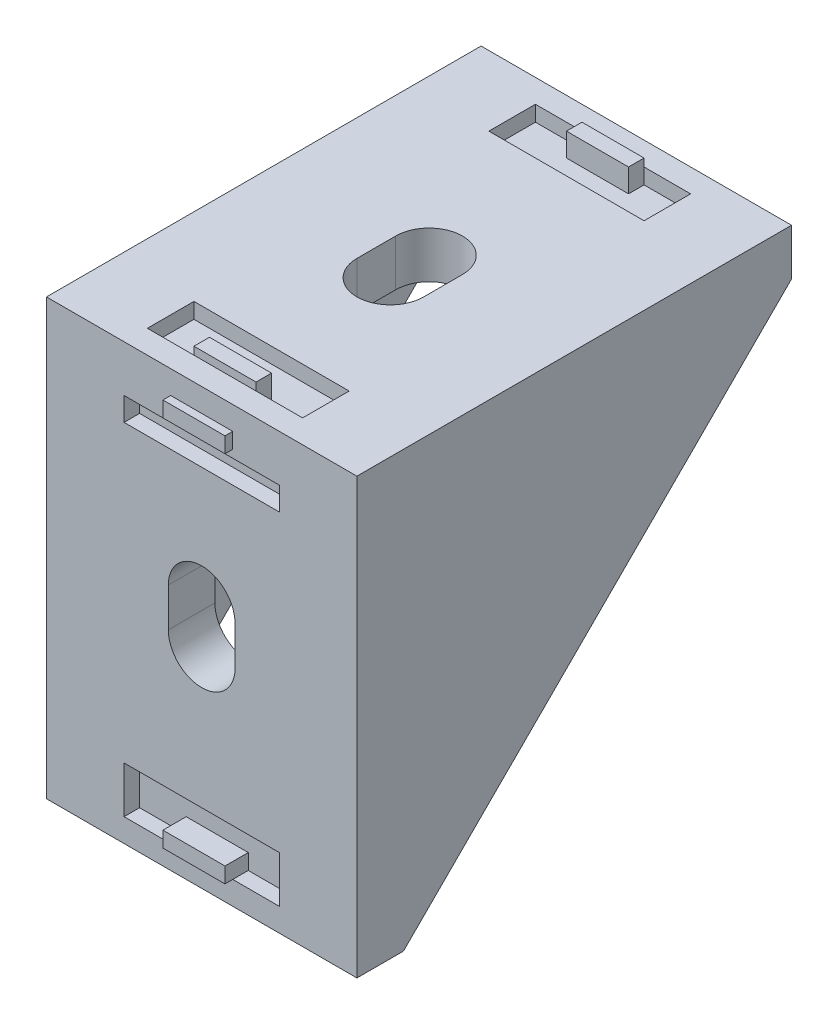
from build123d import *

# Parameters (mm, degrees)
SKETCH_1_W               = 20
SKETCH_1_H               = 28
EXTRUDE_1_DEPTH          = 3
SKETCH_2_W               = 10
SKETCH_2_H               = 3
CUT_EXTRUDE_1_DEPTH      = 1
SKETCH_3_W               = 4
SKETCH_3_H               = 1
EXTRUDE_2_DEPTH          = 1.5
MIRROR_2_COPY_1_SKETCH_W = 10
MIRROR_2_COPY_1_SKETCH_H = 3
MIRROR_2_COPY_1_DEPTH    = 1
MIRROR_2_COPY_2_SKETCH_W = 4
MIRROR_2_COPY_2_SKETCH_H = 1
MIRROR_2_COPY_2_DEPTH    = 1.5
RIB_2_REACH              = 47.252
SKETCH_4_WALL_W          = 127.859233498
SKETCH_4_WALL_H          = 2


with BuildPart() as part:
    # 草图1 → 凸台-拉伸1 (new body)
    with BuildSketch(Plane.XY):
        with Locations((0, 17.480286539)):
            Rectangle(SKETCH_1_W, SKETCH_1_H)
        with BuildLine():
            Line((2.15, 19.330286539), (2.15, 16.830286539))
            ThreePointArc((2.15, 16.830286539), (0, 14.680286539), (-2.15, 16.830286539))
            Line((-2.15, 16.830286539), (-2.15, 19.330286539))
            ThreePointArc((-2.15, 19.330286539), (0, 21.480286539), (2.15, 19.330286539))
        make_face(mode=Mode.SUBTRACT)
    extrude_1 = extrude(amount=EXTRUDE_1_DEPTH)

    # 草图2 → 切除-拉伸1 (cut)
    with BuildSketch(Plane.XY.offset(3)):
        with Locations((0, 28.480286539)):
            Rectangle(SKETCH_2_W, SKETCH_2_H)
    cut_extrude_1 = extrude(amount=-CUT_EXTRUDE_1_DEPTH, mode=Mode.SUBTRACT)

    # 草图3 → 凸台-拉伸2 (add)
    with BuildSketch(Plane.XY.offset(2)):
        with Locations((0, 29.480286539)):
            Rectangle(SKETCH_3_W, SKETCH_3_H)
    extrude_2 = extrude(amount=EXTRUDE_2_DEPTH)

    # 镜向1: 切除-拉伸1, 凸台-拉伸2 across plane
    add(cut_extrude_1.mirror(Plane.ZX.offset(17.480286539)), mode=Mode.SUBTRACT)
    add(extrude_2.mirror(Plane.ZX.offset(17.480286539)))

    # 镜向2: 凸台-拉伸1, 切除-拉伸1, 凸台-拉伸2 across plane
    add(extrude_1.mirror(Plane(origin=(0, 14.240143269, -14.240143269), x_dir=(0, 0.7071067811865478, 0.7071067811865472), z_dir=(0, -0.7071067811865475, 0.7071067811865477))))
    add(cut_extrude_1.mirror(Plane(origin=(0, 14.240143269, -14.240143269), x_dir=(0, 0.7071067811865478, 0.7071067811865472), z_dir=(0, -0.7071067811865475, 0.7071067811865477))), mode=Mode.SUBTRACT)
    add(extrude_2.mirror(Plane(origin=(0, 14.240143269, -14.240143269), x_dir=(0, 0.7071067811865478, 0.7071067811865472), z_dir=(0, -0.7071067811865475, 0.7071067811865477))))

    # 镜向2 copy 1 sketch → 镜向2 copy 1 (cut)
    with BuildSketch(Plane(origin=(0, 31.480286539, 6.480286539), x_dir=(1, 0, 0), z_dir=(0, 1, 0))):
        with Locations((0, 28.480286539)):
            Rectangle(MIRROR_2_COPY_1_SKETCH_W, MIRROR_2_COPY_1_SKETCH_H)
    extrude(amount=-MIRROR_2_COPY_1_DEPTH, mode=Mode.SUBTRACT)

    # 镜向2 copy 2 sketch → 镜向2 copy 2 (add)
    with BuildSketch(Plane(origin=(0, 30.480286539, 6.480286539), x_dir=(1, 0, 0), z_dir=(0, 1, 0))):
        with Locations((0, 29.480286539)):
            Rectangle(MIRROR_2_COPY_2_SKETCH_W, MIRROR_2_COPY_2_SKETCH_H)
    extrude(amount=MIRROR_2_COPY_2_DEPTH)

    # 草图4 wall → 筋2 (add, up to next)
    with BuildSketch(Plane(origin=(10, 15.980286539, -12.5), x_dir=(0, 0.707106781187, -0.707106781187), z_dir=(0, 0.707106781187, 0.707106781187)), mode=Mode.PRIVATE) as rib_2_sk1:
        with Locations((0, 1)):
            Rectangle(SKETCH_4_WALL_W, SKETCH_4_WALL_H)
    rib_2_tool1 = extrude(rib_2_sk1.sketch, amount=RIB_2_REACH, mode=Mode.PRIVATE) - part.part
    rib_2 = rib_2_tool1.solids().sort_by_distance((10, 15.980286539, -12.5))[0]
    add(rib_2)

    # 镜向3: 筋2 across plane
    add(rib_2.mirror(Plane.ZY))


solid = part.part
